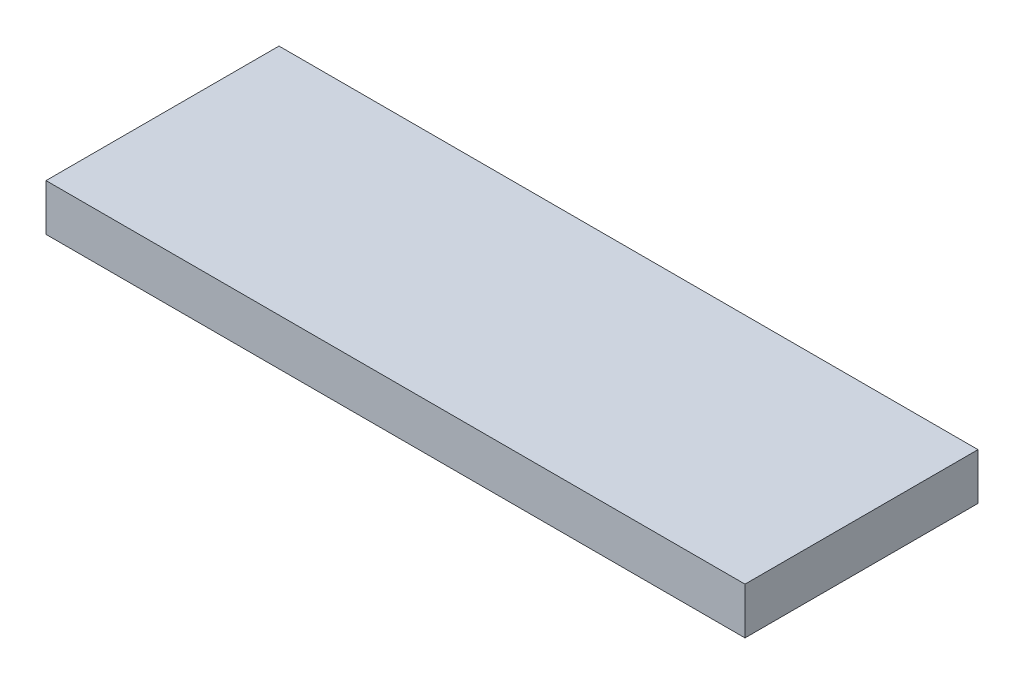
from build123d import *

# Parameters (mm, degrees)
SKETCH_1_W      = 45
SKETCH_1_H      = 15
EXTRUDE_1_DEPTH = 3


with BuildPart() as part:
    # 草图1 → 凸台-拉伸1 (new body)
    with BuildSketch(Plane(origin=(0, 0, 0), x_dir=(1, 0, 0), z_dir=(0, 1, 0))):
        with Locations((2.076923077, 4.326923077)):
            Rectangle(SKETCH_1_W, SKETCH_1_H)
    extrude(amount=EXTRUDE_1_DEPTH)


solid = part.part
